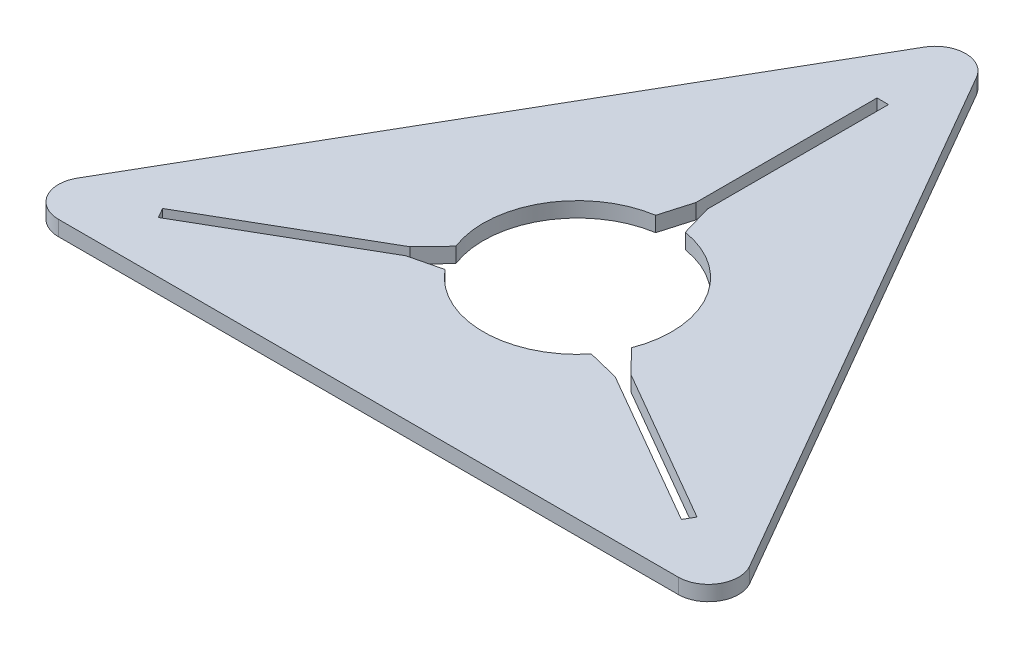
from build123d import *

# Parameters (mm, degrees)
BOSS_EXTRUDE1_DEPTH = 6.35
FILLET1_R           = 12.7


with BuildPart() as part:
    # Sketch1 → Boss-Extrude1 (new body)
    with BuildSketch(Plane(origin=(0, 0, 0), x_dir=(1, 0, 0), z_dir=(0, 1, 0))):
        Polygon((74.847393185, 251.565850448), (-77.552606815, -12.398692626), (227.247393185, -12.398692626), align=None)
        with BuildLine():
            Line((68.624393185, 114.721772347), (72.434393185, 127.839947397))
            Line((72.434393185, 127.839947397), (72.434393185, 204.039947397))
            Line((72.434393185, 204.039947397), (77.260393185, 204.039947397))
            Line((77.260393185, 204.039947397), (77.260393185, 127.839947397))
            Line((77.260393185, 127.839947397), (81.070393185, 114.721772347))
            ThreePointArc((81.070393185, 114.721772347), (104.985753525, 101.313807865), (114.471393185, 75.589488399))
            ThreePointArc((114.471393185, 75.589488399), (113.810138601, 68.380754416), (111.848445192, 61.412622513))
            Line((111.848445192, 61.412622513), (121.304118037, 51.553978199))
            Line((121.304118037, 51.553978199), (187.295253805, 13.453978199))
            Line((187.295253805, 13.453978199), (184.882253805, 9.2745396))
            Line((184.882253805, 9.2745396), (118.891118037, 47.3745396))
            Line((118.891118037, 47.3745396), (105.625445192, 50.634070337))
            ThreePointArc((105.625445192, 50.634070337), (74.847393185, 35.965488399), (44.069341177, 50.634070337))
            Line((44.069341177, 50.634070337), (30.803668332, 47.3745396))
            Line((30.803668332, 47.3745396), (-35.187467436, 9.2745396))
            Line((-35.187467436, 9.2745396), (-37.600467436, 13.453978199))
            Line((-37.600467436, 13.453978199), (28.390668332, 51.553978199))
            Line((28.390668332, 51.553978199), (37.846341177, 61.412622512))
            ThreePointArc((37.846341177, 61.412622512), (40.532002585, 95.401488399), (68.624393185, 114.721772347))
        make_face(mode=Mode.SUBTRACT)
    extrude(amount=BOSS_EXTRUDE1_DEPTH)

    # Fillet1
    fillet1_edges = [part.edges().sort_by_distance(p)[0] for p in [
        (-77.552606815, 3.175, 12.398692626),
        (74.847393185, 3.175, -251.565850448),
        (227.247393185, 3.175, 12.398692626),
    ]]
    fillet(fillet1_edges, radius=FILLET1_R)


solid = part.part
